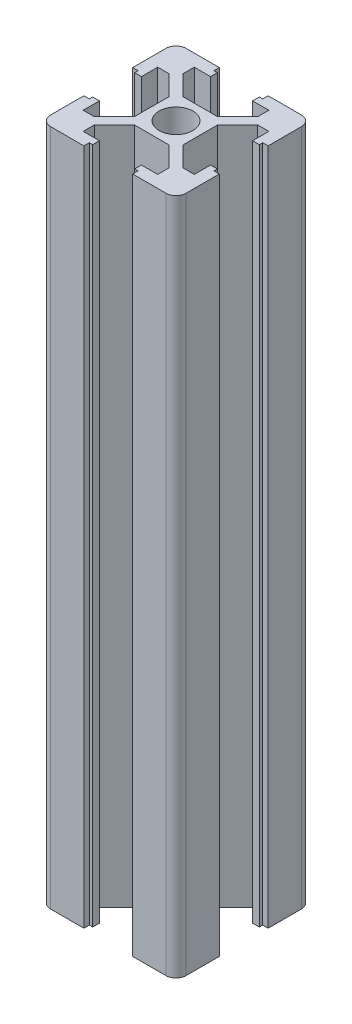
from build123d import *

# Parameters (mm, degrees)
SKETCH_1_R      = 2.5
EXTRUDE_1_DEPTH = 100


with BuildPart() as part:
    # 草图1 → 凸台-拉伸1 (new body)
    with BuildSketch(Plane(origin=(0, 0, 0), x_dir=(1, 0, 0), z_dir=(0, 1, 0))):
        with BuildLine():
            Line((-0.913659552, 3.230113086), (-0.913659552, -1.84856657))
            Line((-0.913659552, -1.84856657), (-3.874319724, -4.809226742))
            Line((-3.874319724, -4.809226742), (-5.513659552, -4.809226742))
            Line((-5.513659552, -4.809226742), (-5.513659552, -2.409226742))
            Line((-5.513659552, -2.409226742), (-6.513659552, -2.409226742))
            Line((-6.513659552, -2.409226742), (-6.513659552, -2.909226742))
            Line((-6.513659552, -2.909226742), (-7.313659552, -2.909226742))
            Line((-7.313659552, -2.909226742), (-7.313659552, -7.809226742))
            ThreePointArc((-7.313659552, -7.809226742), (-6.874319724, -8.869886914), (-5.813659552, -9.309226742))
            Line((-5.813659552, -9.309226742), (-0.913659552, -9.309226742))
            Line((-0.913659552, -9.309226742), (-0.913659552, -8.509226742))
            Line((-0.913659552, -8.509226742), (-0.413659552, -8.509226742))
            Line((-0.413659552, -8.509226742), (-0.413659552, -7.509226742))
            Line((-0.413659552, -7.509226742), (-2.813659552, -7.509226742))
            Line((-2.813659552, -7.509226742), (-2.813659552, -5.869886914))
            Line((-2.813659552, -5.869886914), (0.14700062, -2.909226742))
            Line((0.14700062, -2.909226742), (5.225680276, -2.909226742))
            Line((5.225680276, -2.909226742), (8.186340448, -5.869886914))
            Line((8.186340448, -5.869886914), (8.186340448, -7.509226742))
            Line((8.186340448, -7.509226742), (5.786340448, -7.509226742))
            Line((5.786340448, -7.509226742), (5.786340448, -8.509226742))
            Line((5.786340448, -8.509226742), (6.286340448, -8.509226742))
            Line((6.286340448, -8.509226742), (6.286340448, -9.309226742))
            Line((6.286340448, -9.309226742), (11.186340448, -9.309226742))
            ThreePointArc((11.186340448, -9.309226742), (12.24700062, -8.869886914), (12.686340448, -7.809226742))
            Line((12.686340448, -7.809226742), (12.686340448, -2.909226742))
            Line((12.686340448, -2.909226742), (11.886340448, -2.909226742))
            Line((11.886340448, -2.909226742), (11.886340448, -2.409226742))
            Line((11.886340448, -2.409226742), (10.886340448, -2.409226742))
            Line((10.886340448, -2.409226742), (10.886340448, -4.809226742))
            Line((10.886340448, -4.809226742), (9.24700062, -4.809226742))
            Line((9.24700062, -4.809226742), (6.286340448, -1.84856657))
            Line((6.286340448, -1.84856657), (6.286340448, 3.230113086))
            Line((6.286340448, 3.230113086), (9.24700062, 6.190773258))
            Line((9.24700062, 6.190773258), (10.886340448, 6.190773258))
            Line((10.886340448, 6.190773258), (10.886340448, 3.790773258))
            Line((10.886340448, 3.790773258), (11.886340448, 3.790773258))
            Line((11.886340448, 3.790773258), (11.886340448, 4.290773258))
            Line((11.886340448, 4.290773258), (12.686340448, 4.290773258))
            Line((12.686340448, 4.290773258), (12.686340448, 9.190773258))
            ThreePointArc((12.686340448, 9.190773258), (12.24700062, 10.25143343), (11.186340448, 10.690773258))
            Line((11.186340448, 10.690773258), (6.286340448, 10.690773258))
            Line((6.286340448, 10.690773258), (6.286340448, 9.890773258))
            Line((6.286340448, 9.890773258), (5.786340448, 9.890773258))
            Line((5.786340448, 9.890773258), (5.786340448, 8.890773258))
            Line((5.786340448, 8.890773258), (8.186340448, 8.890773258))
            Line((8.186340448, 8.890773258), (8.186340448, 7.25143343))
            Line((8.186340448, 7.25143343), (5.225680276, 4.290773258))
            Line((5.225680276, 4.290773258), (0.14700062, 4.290773258))
            Line((0.14700062, 4.290773258), (-2.813659552, 7.25143343))
            Line((-2.813659552, 7.25143343), (-2.813659552, 8.890773258))
            Line((-2.813659552, 8.890773258), (-0.413659552, 8.890773258))
            Line((-0.413659552, 8.890773258), (-0.413659552, 9.890773258))
            Line((-0.413659552, 9.890773258), (-0.913659552, 9.890773258))
            Line((-0.913659552, 9.890773258), (-0.913659552, 10.690773258))
            Line((-0.913659552, 10.690773258), (-5.813659552, 10.690773258))
            ThreePointArc((-5.813659552, 10.690773258), (-6.874319724, 10.25143343), (-7.313659552, 9.190773258))
            Line((-7.313659552, 9.190773258), (-7.313659552, 4.290773258))
            Line((-7.313659552, 4.290773258), (-6.513659552, 4.290773258))
            Line((-6.513659552, 4.290773258), (-6.513659552, 3.790773258))
            Line((-6.513659552, 3.790773258), (-5.513659552, 3.790773258))
            Line((-5.513659552, 3.790773258), (-5.513659552, 6.190773258))
            Line((-5.513659552, 6.190773258), (-3.874319724, 6.190773258))
            Line((-3.874319724, 6.190773258), (-0.913659552, 3.230113086))
        make_face()
        with Locations(Location((2.686340448, 0.690773258, 0), (0, 0, 270))):
            Circle(SKETCH_1_R, mode=Mode.SUBTRACT)
    extrude(amount=EXTRUDE_1_DEPTH)


solid = part.part
